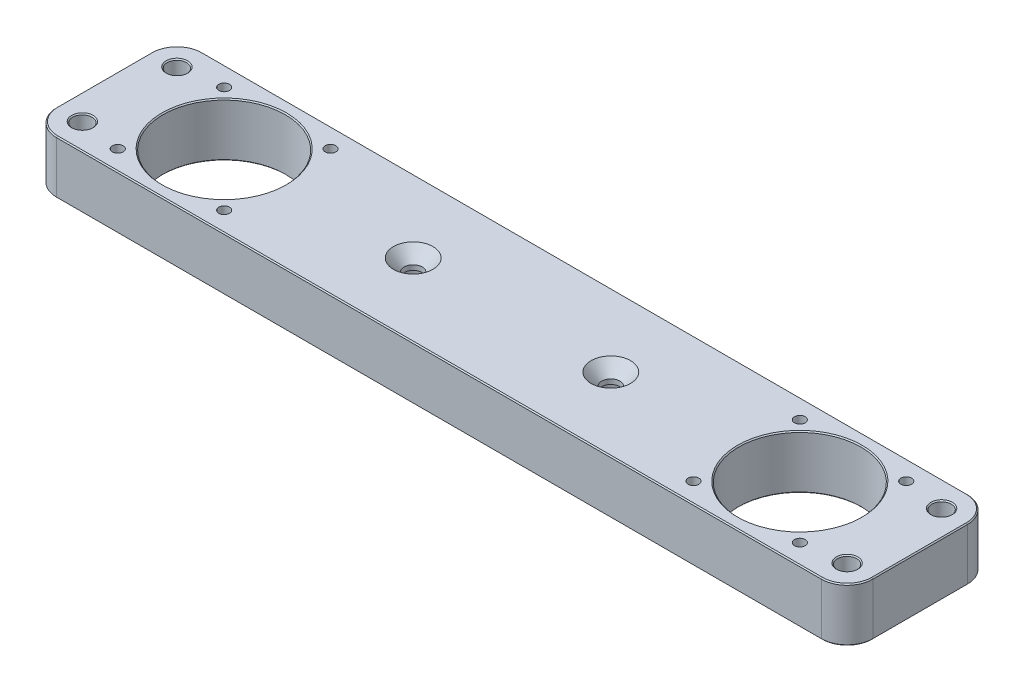
from build123d import *

# Parameters (mm, degrees)
SKETCH1_W                                            = 380
SKETCH1_H                                            = 68
BOSS_EXTRUDE1_DEPTH                                  = 25
SKETCH2_R                                            = 28.5
CUT_EXTRUDE1_DEPTH                                   = 195.630419
CUT_EXTRUDE2_DEPTH                                   = 195.630419
CUT_EXTRUDE2_DEPTH_BACK                              = 195.630419
SKETCH4_R                                            = 9.55
CHAMFER1_SIZE                                        = 0.5
FILLET1_R                                            = 12
M8_CLEARANCE_HOLE1_D                                 = 9
CHAMFER2_SIZE                                        = 0.5
CHAMFER3_SIZE                                        = 0.5
M6X1_0_TAPPED_HOLE1_D                                = 5
SKETCH13_R                                           = 13.411040831
SKETCH13_R_2                                         = 14.724493856
BOSS_EXTRUDE3_DEPTH                                  = 8
CSK_FOR_5_16_FLAT_HEAD_SOCKET_CAP_SCREW1_D           = 8.4328
CSK_FOR_5_16_FLAT_HEAD_SOCKET_CAP_SCREW1_CSINK_D     = 18.4009792
CSK_FOR_5_16_FLAT_HEAD_SOCKET_CAP_SCREW1_CSINK_ANGLE = 82


with BuildPart() as part:
    # Sketch1 → Boss-Extrude1 (new body)
    with BuildSketch(Plane(origin=(0, 0, 0), x_dir=(1, 0, 0), z_dir=(0, 1, 0))):
        Rectangle(SKETCH1_W, SKETCH1_H)
    extrude(amount=BOSS_EXTRUDE1_DEPTH)

    # Sketch2 → Cut-Extrude1 (cut, through all)
    with BuildSketch(Plane(origin=(0, 25, 0), x_dir=(1, 0, 0), z_dir=(0, 1, 0))):
        with Locations(Location((-134, 0, 0), (0, 0, 270))):
            Circle(SKETCH2_R)
        with Locations(Location((134, 0, 0), (0, 0, 270))):
            Circle(SKETCH2_R)
    extrude(amount=-CUT_EXTRUDE1_DEPTH, mode=Mode.SUBTRACT)

    # Sketch4 → Cut-Extrude2 (cut, two sides: drawn at the far end of the back side and taken through both)
    with BuildSketch(Plane(origin=(0, 25, 0), x_dir=(1, 0, 0), z_dir=(0, 1, 0)).offset(-CUT_EXTRUDE2_DEPTH_BACK)):
        with Locations(Location((-46, 0, 0), (0, 0, 270))):
            Circle(SKETCH4_R)
        with Locations(Location((46, 0, 0), (0, 0, 270))):
            Circle(SKETCH4_R)
    extrude(amount=CUT_EXTRUDE2_DEPTH + CUT_EXTRUDE2_DEPTH_BACK, mode=Mode.SUBTRACT)

    # Chamfer1
    chamfer1_edges = [part.edges().sort_by_distance(p)[0] for p in [
        (-134, 0, -28.5),
        (-134, 25, -28.5),
        (134, 0, -28.5),
        (134, 25, -28.5),
        (-46, 0, -9.55),
        (-46, 25, -9.55),
        (46, 0, -9.55),
        (46, 25, -9.55),
    ]]
    chamfer(chamfer1_edges, length=CHAMFER1_SIZE)

    # Fillet1
    fillet1_edges = [part.edges().sort_by_distance(p)[0] for p in [
        (190, 12.5, 34),
        (-190, 12.5, 34),
        (-190, 12.5, -34),
        (190, 12.5, -34),
    ]]
    fillet(fillet1_edges, radius=FILLET1_R)

    # M8 Clearance Hole1 (through all)
    with Locations(Plane.XZ):
        with Locations((-178, -22), (-178, 22), (178, -22), (178, 22)):
            Hole(M8_CLEARANCE_HOLE1_D / 2)

    # Chamfer2
    chamfer2_edges = [part.edges().sort_by_distance(p)[0] for p in [
        (190, 0, 0),
        (0, 0, 34),
        (-190, 0, 0),
        (0, 0, -34),
        (-186.485281374, 0, 30.485281374),
        (-186.485281374, 0, -30.485281374),
        (186.485281374, 0, -30.485281374),
        (186.485281374, 0, 30.485281374),
    ]]
    chamfer(chamfer2_edges, length=CHAMFER2_SIZE)

    # Chamfer3
    chamfer3_edges = [part.edges().sort_by_distance(p)[0] for p in [
        (-173.5, 0, 22),
        (-173.5, 25, 22),
        (-173.5, 0, -22),
        (-173.5, 25, -22),
        (190, 25, 0),
        (0, 25, 34),
        (0, 25, -34),
        (-190, 25, 0),
        (-186.485281374, 25, 30.485281374),
        (-186.485281374, 25, -30.485281374),
        (186.485281374, 25, -30.485281374),
        (186.485281374, 25, 30.485281374),
        (182.5, 0, 22),
        (182.5, 25, 22),
        (182.5, 0, -22),
        (182.5, 25, -22),
    ]]
    chamfer(chamfer3_edges, length=CHAMFER3_SIZE)

    # M6x1.0 Tapped Hole1 (through all)
    with Locations(Plane(origin=(0, 0, 0), x_dir=(-1, 0, 0), z_dir=(0, -1, 0))):
        with Locations((158.765, -24.765), (109.235, -24.765), (109.235, 24.765), (158.765, 24.765), (-109.235, -24.765), (-158.765, -24.765), (-109.235, 24.765), (-158.765, 24.765)):
            Hole(M6X1_0_TAPPED_HOLE1_D / 2)

    # Sketch13 → Boss-Extrude3 (add)
    with BuildSketch(Plane(origin=(0, 25, 0), x_dir=(1, 0, 0), z_dir=(0, 1, 0))):
        with Locations((46, 0)):
            Circle(SKETCH13_R)
        with Locations((-46, 0)):
            Circle(SKETCH13_R_2)
    extrude(amount=-BOSS_EXTRUDE3_DEPTH)

    # CSK for 5/16 Flat Head Socket Cap Screw1 (through all)
    with Locations(Plane(origin=(0, 25, 0), x_dir=(1, 0, 0), z_dir=(0, 1, 0))):
        with Locations((46, 0), (-46, 0)):
            CounterSinkHole(CSK_FOR_5_16_FLAT_HEAD_SOCKET_CAP_SCREW1_D / 2, CSK_FOR_5_16_FLAT_HEAD_SOCKET_CAP_SCREW1_CSINK_D / 2, counter_sink_angle=CSK_FOR_5_16_FLAT_HEAD_SOCKET_CAP_SCREW1_CSINK_ANGLE)


solid = part.part
